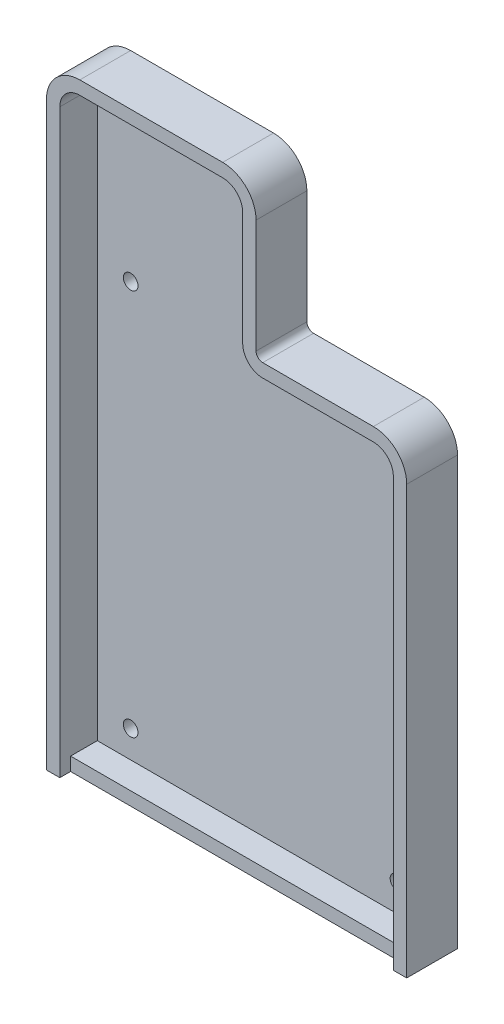
from build123d import *

# Parameters (mm, degrees)
BOSS_EXTRUDE1_DEPTH = 7.62
BOSS_EXTRUDE2_DEPTH = 6.004598
SKETCH12_R          = 2.1
SKETCH12_R_2        = 1.1
BOSS_EXTRUDE5_DEPTH = 6.0045981
SKETCH13_R          = 1.1
CUT_EXTRUDE5_DEPTH  = 6.0045981
SKETCH11_W          = 50
SKETCH11_H          = 1.6154019
CUT_EXTRUDE6_DEPTH  = 2
CUT_EXTRUDE7_DEPTH  = 4.0045981


with BuildPart() as part:
    # Sketch3 → Boss-Extrude1 (new body)
    with BuildSketch(Plane.XY):
        with BuildLine():
            Line((251.999999934, 224.000364601), (252, 159.907096774))
            Line((252, 159.907096774), (198, 159.907096774))
            Line((198, 159.907096774), (198.000000066, 247.000364601))
            ThreePointArc((198.000000066, 247.000364601), (199.464786475, 250.535213525), (202.999635399, 251.999999934))
            Line((202.999635399, 251.999999934), (224.416364601, 251.999999934))
            ThreePointArc((224.416364601, 251.999999934), (227.951213525, 250.535213525), (229.415999934, 247.000364601))
            Line((229.415999934, 247.000364601), (229.415999934, 230.000364601))
            ThreePointArc((229.415999934, 230.000364601), (229.709213468, 229.293213468), (230.416364601, 228.999999934))
            Line((230.416364601, 228.999999934), (247.000364601, 228.999999934))
            ThreePointArc((247.000364601, 228.999999934), (250.535213525, 227.535213525), (251.999999934, 224.000364601))
        make_face()
        with BuildLine():
            Line((200, 161.907096774), (250, 161.907096774))
            Line((250, 161.907096774), (250, 224))
            ThreePointArc((250, 224), (249.121, 226.121), (247, 227))
            Line((247, 227), (230.416, 227))
            ThreePointArc((230.416, 227), (228.295, 227.879), (227.416, 230))
            Line((227.416, 230), (227.416, 247))
            ThreePointArc((227.416, 247), (226.537, 249.121), (224.416, 250))
            Line((224.416, 250), (203, 250))
            ThreePointArc((203, 250), (200.879, 249.121), (200, 247))
            Line((200, 247), (200, 161.907096774))
        make_face(mode=Mode.SUBTRACT)
    extrude(amount=-BOSS_EXTRUDE1_DEPTH)



with BuildPart() as body_2:
    # Sketch5 → Boss-Extrude2 (new body)
    with BuildSketch(Plane(origin=(0, 0, -1.6154019), x_dir=(-1, 0, 0), z_dir=(0, 0, -1))):
        with BuildLine():
            Line((-200, 161.907096774), (-250, 161.907096774))
            Line((-250, 161.907096774), (-250, 224))
            ThreePointArc((-250, 224), (-249.121, 226.121), (-247, 227))
            Line((-247, 227), (-230.416, 227))
            ThreePointArc((-230.416, 227), (-228.295, 227.879), (-227.416, 230))
            Line((-227.416, 230), (-227.416, 247))
            ThreePointArc((-227.416, 247), (-226.537, 249.121), (-224.416, 250))
            Line((-224.416, 250), (-203, 250))
            ThreePointArc((-203, 250), (-200.879, 249.121), (-200, 247))
            Line((-200, 247), (-200, 161.907096774))
        make_face()
    extrude(amount=BOSS_EXTRUDE2_DEPTH)


with BuildPart() as part_1:
    add(part.part)

    add(body_2.part)  # Boss-Extrude5 merges body 2
    # Sketch12 → Boss-Extrude5 (add)
    # profile 1 of 4: a face of its own
    with BuildSketch(Plane(origin=(0, 0, -1.6154019), x_dir=(-1, 0, 0), z_dir=(0, 0, -1))):
        with Locations((-245, 166)):
            Circle(SKETCH12_R)
        with Locations((-245, 166)):
            Circle(SKETCH12_R_2, mode=Mode.SUBTRACT)
    # profile 2 of 4: a face of its own
    with BuildSketch(Plane(origin=(0, 0, -1.6154019), x_dir=(-1, 0, 0), z_dir=(0, 0, -1))):
        with Locations((-205, 166)):
            Circle(SKETCH12_R)
        with Locations((-205, 166)):
            Circle(SKETCH12_R_2, mode=Mode.SUBTRACT)
    # profile 3 of 4: a face of its own
    with BuildSketch(Plane(origin=(0, 0, -1.6154019), x_dir=(-1, 0, 0), z_dir=(0, 0, -1))):
        with Locations((-225, 224)):
            Circle(SKETCH12_R)
        with Locations((-225, 224)):
            Circle(SKETCH12_R_2, mode=Mode.SUBTRACT)
    # profile 4 of 4: a face of its own
    with BuildSketch(Plane(origin=(0, 0, -1.6154019), x_dir=(-1, 0, 0), z_dir=(0, 0, -1))):
        with Locations((-205, 224)):
            Circle(SKETCH12_R)
        with Locations((-205, 224)):
            Circle(SKETCH12_R_2, mode=Mode.SUBTRACT)
    extrude(amount=BOSS_EXTRUDE5_DEPTH)

    # Sketch13 → Cut-Extrude5 (cut)
    with BuildSketch(Plane(origin=(0, 0, -1.6154019), x_dir=(-1, 0, 0), z_dir=(0, 0, -1))):
        with Locations(Location((-225, 224, 0), (0, 0, 180))):
            Circle(SKETCH13_R)
        with Locations(Location((-205, 224, 0), (0, 0, 180))):
            Circle(SKETCH13_R)
        with Locations(Location((-205, 166, 0), (0, 0, 180))):
            Circle(SKETCH13_R)
        with Locations(Location((-245, 166, 0), (0, 0, 180))):
            Circle(SKETCH13_R)
    extrude(amount=CUT_EXTRUDE5_DEPTH, mode=Mode.SUBTRACT)

    # Sketch11 → Cut-Extrude6 (cut)
    with BuildSketch(Plane.XZ.offset(-159.907096774)):
        with Locations((225, -0.80770095)):
            Rectangle(SKETCH11_W, SKETCH11_H)
    extrude(amount=-CUT_EXTRUDE6_DEPTH, mode=Mode.SUBTRACT)

    # Sketch9 → Cut-Extrude7 (cut)
    with BuildSketch(Plane.XY.offset(-1.6154019)):
        with BuildLine():
            Line((200, 161.907096774), (250, 161.907096774))
            Line((250, 161.907096774), (250, 224))
            ThreePointArc((250, 224), (249.121, 226.121), (247, 227))
            Line((247, 227), (230.416, 227))
            ThreePointArc((230.416, 227), (228.295, 227.879), (227.416, 230))
            Line((227.416, 230), (227.416, 247))
            ThreePointArc((227.416, 247), (226.537, 249.121), (224.416, 250))
            Line((224.416, 250), (203, 250))
            ThreePointArc((203, 250), (200.879, 249.121), (200, 247))
            Line((200, 247), (200, 161.907096774))
        make_face()
    extrude(amount=-CUT_EXTRUDE7_DEPTH, mode=Mode.SUBTRACT)


solid = part_1.part
